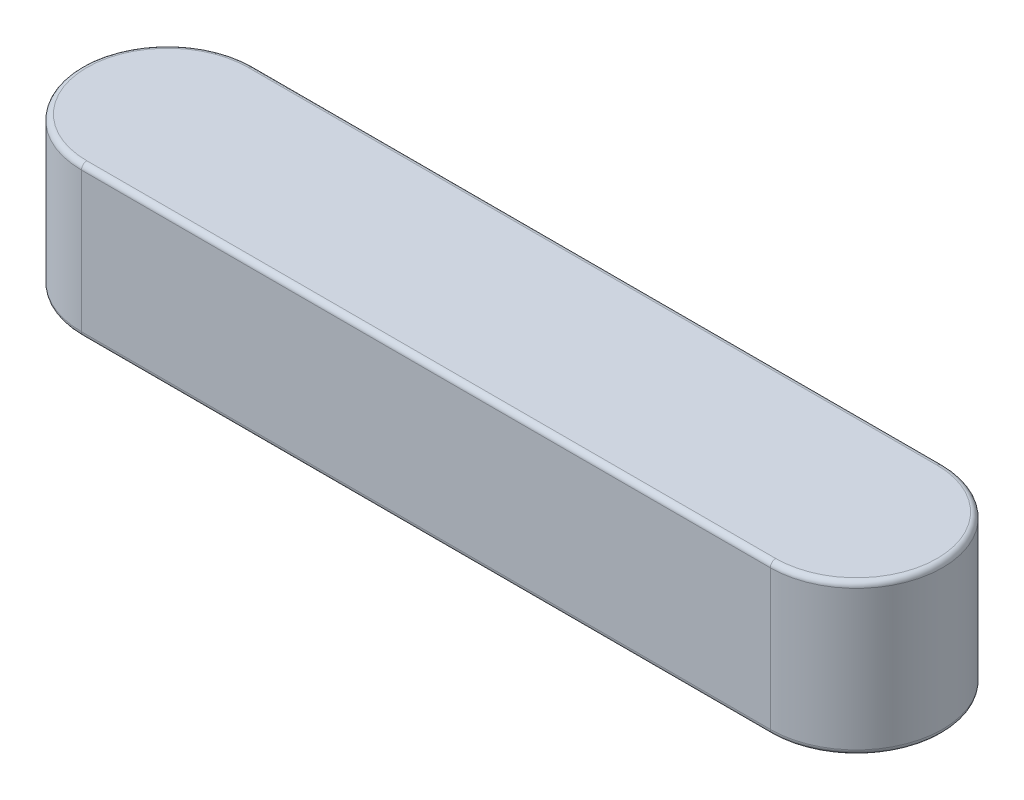
from build123d import *

# Parameters (mm, degrees)
EXTRUDE1_DEPTH = 7
FILLET1_R      = 0.25


with BuildPart() as part:
    # Sketch1 → Extrude1 (new body)
    with BuildSketch(Plane(origin=(0, 0, 0), x_dir=(1, 0, 0), z_dir=(0, 1, 0))):
        with BuildLine():
            Line((-32, 4), (0, 4))
            ThreePointArc((0, 4), (4, 0), (0, -4))
            Line((0, -4), (-32, -4))
            ThreePointArc((-32, -4), (-36, 0), (-32, 4))
        make_face()
    extrude(amount=EXTRUDE1_DEPTH)

    # Fillet1
    fillet1_edges = [part.edges().sort_by_distance(p)[0] for p in [
        (4, 7, 0),
        (-16, 7, -4),
        (-36, 7, 0),
        (-16, 0, -4),
        (4, 0, 0),
        (-16, 0, 4),
        (-36, 0, 0),
        (-16, 7, 4),
    ]]
    fillet(fillet1_edges, radius=FILLET1_R)


solid = part.part
